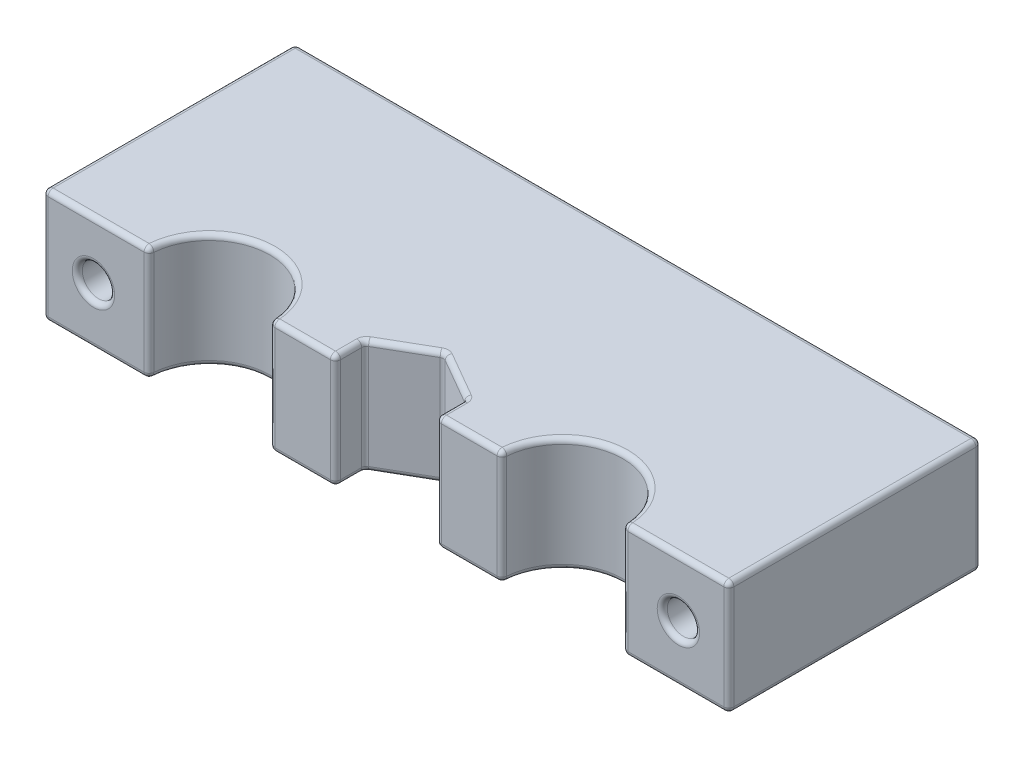
from build123d import *

# Parameters (mm, degrees)
BOSS_EXTRUDE1_DEPTH = 11.3
SKETCH2_R           = 1.6
CUT_EXTRUDE1_DEPTH  = 74.325916292
FILLET1_R           = 0.5


with BuildPart() as part:
    # Sketch1 → Boss-Extrude1 (new body)
    with BuildSketch(Plane(origin=(0, 0, 0), x_dir=(1, 0, 0), z_dir=(0, 1, 0))):
        with BuildLine():
            Line((57.5, 0), (68, 0))
            Line((68, 0), (68, 25))
            Line((68, 25), (0, 25))
            Line((0, 25), (0, 0))
            Line((0, 0), (10.5, 0))
            ThreePointArc((10.5, 0), (16.5, 6), (22.5, 0))
            Line((22.5, 0), (29, 0))
            Line((29, 0), (29, 2.886751346))
            Line((29, 2.886751346), (34, 5.773502692))
            Line((34, 5.773502692), (39, 2.886751346))
            Line((39, 2.886751346), (39, 0))
            Line((39, 0), (45.5, 0))
            ThreePointArc((45.5, 0), (51.5, 6), (57.5, 0))
        make_face()
    extrude(amount=BOSS_EXTRUDE1_DEPTH)

    # Sketch2 → Cut-Extrude1 (cut, through all)
    with BuildSketch(Plane(origin=(0, 0, -25), x_dir=(-1, 0, 0), z_dir=(0, 0, -1))):
        with Locations((-5, 5.65)):
            Circle(SKETCH2_R)
        with Locations(Location((-63, 5.65, 0), (0, 0, 180))):
            Circle(SKETCH2_R)
    extrude(amount=-CUT_EXTRUDE1_DEPTH, mode=Mode.SUBTRACT)

    # Fillet1
    fillet1_edges = [part.edges().sort_by_distance(p)[0] for p in [
        (25.75, 11.3, 0),
        (0, 0, -12.5),
        (34, 0, -25),
        (68, 0, -12.5),
        (62.75, 0, 0),
        (51.5, 0, -6),
        (42.25, 0, 0),
        (39, 0, -1.443375673),
        (36.5, 0, -4.330127019),
        (31.5, 0, -4.330127019),
        (29, 0, -1.443375673),
        (29, 11.3, -1.443375673),
        (25.75, 0, 0),
        (16.5, 0, -6),
        (5.25, 0, 0),
        (31.5, 11.3, -4.330127019),
        (0, 5.65, 0),
        (0, 5.65, -25),
        (68, 5.65, -25),
        (68, 5.65, 0),
        (57.5, 5.65, 0),
        (45.5, 5.65, 0),
        (39, 5.65, 0),
        (39, 5.65, -2.886751346),
        (34, 5.65, -5.773502692),
        (29, 5.65, -2.886751346),
        (29, 5.65, 0),
        (22.5, 5.65, 0),
        (10.5, 5.65, 0),
        (36.5, 11.3, -4.330127019),
        (39, 11.3, -1.443375673),
        (42.25, 11.3, 0),
        (51.5, 11.3, -6),
        (6.6, 5.65, 0),
        (6.6, 5.65, -25),
        (62.75, 11.3, 0),
        (61.4, 5.65, 0),
        (61.4, 5.65, -25),
        (68, 11.3, -12.5),
        (34, 11.3, -25),
        (5.25, 11.3, 0),
        (0, 11.3, -12.5),
        (16.5, 11.3, -6),
    ]]
    fillet(fillet1_edges, radius=FILLET1_R)


solid = part.part
